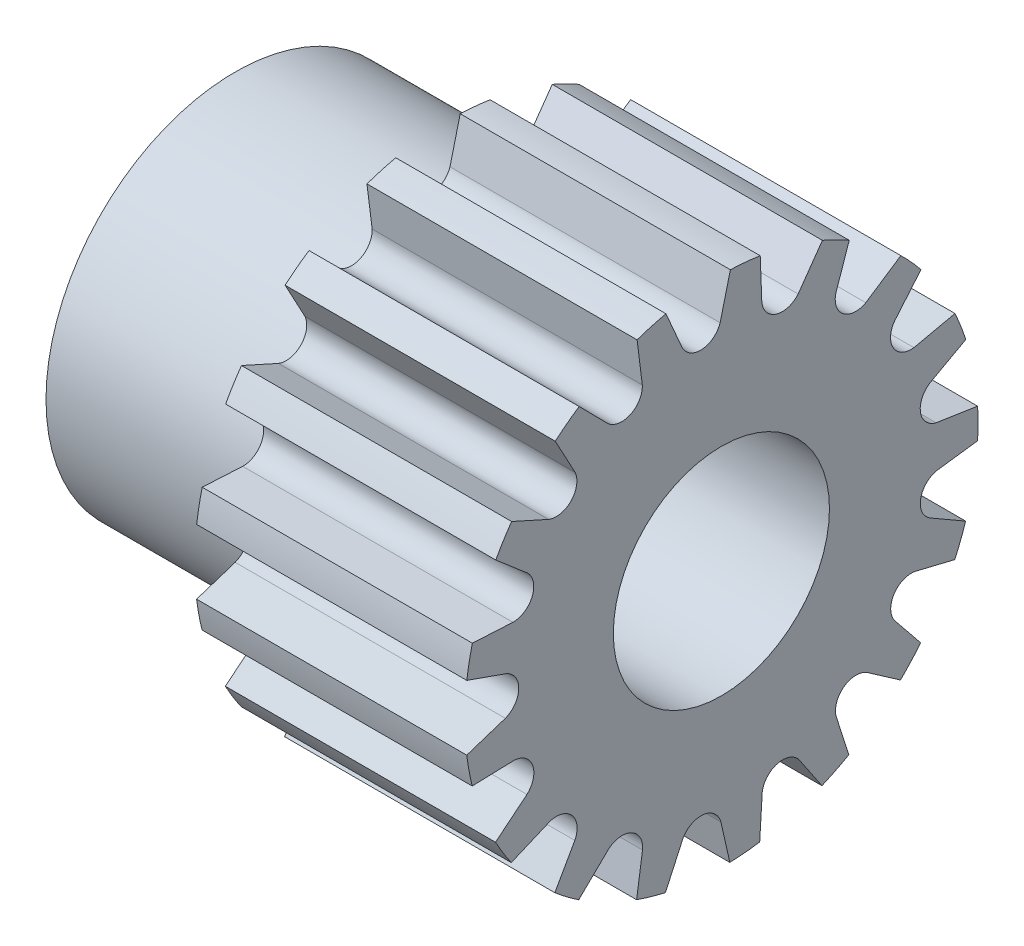
from build123d import *

# Parameters (mm, degrees)
SKETCH_2_R               = 4
CUT_EXTRUDE_1_DEPTH      = 20
CUT_EXTRUDE_2_DEPTH      = 10
PATTERN_CIRCULAR_1_COUNT = 17
SKETCH_4_R               = 2
CUT_EXTRUDE_3_DEPTH      = 10
SKETCH_5_R               = 2
CUT_EXTRUDE_4_DEPTH      = 10


with BuildPart() as part:
    # Эскиз1 → Повернуть1 (revolve)
    with BuildSketch(Plane.XY):
        Polygon((18, 0), (18, 9.5), (8, 9.5), (8, 7), (0, 7), (0, 0), align=None)
    revolve(axis=Axis((0, 0, 0), (1, 0, 0)))

    # Эскиз2 → Вырез-Вытянуть1 (cut)
    with BuildSketch(Plane.ZY):
        Circle(SKETCH_2_R)
    extrude(amount=-CUT_EXTRUDE_1_DEPTH, mode=Mode.SUBTRACT)

    # Эскиз3 → Вырез-Вытянуть2 (cut)
    with BuildSketch(Plane.ZY.offset(-8)):
        with BuildLine():
            Line((0.046298541, 7.983921855), (-0.332359624, 9.494184382))
            ThreePointArc((-0.332359624, 9.494184382), (0.866716129, 9.460380709), (2.051973159, 9.27574289))
            Line((2.051973159, 9.27574289), (1.455655646, 7.897482676))
            ThreePointArc((1.455655646, 7.897482676), (0.721917095, 7.466890324), (0.046298541, 7.983921855))
        make_face()
    cut_extrude_2 = extrude(amount=-CUT_EXTRUDE_2_DEPTH, mode=Mode.SUBTRACT)

    # Круговой массив1: Вырез-Вытянуть2 ×17 about axis
    pattern_circular_1_axis = Axis((18, 0, 0), (-1, 0, 0))
    for i in range(1, PATTERN_CIRCULAR_1_COUNT):
        add(cut_extrude_2.rotate(pattern_circular_1_axis, i * 360 / PATTERN_CIRCULAR_1_COUNT), mode=Mode.SUBTRACT)

    # Эскиз4 → Вырез-Вытянуть3 (cut)
    with BuildSketch(Plane(origin=(0, 0, 0), x_dir=(1, 0, 0), z_dir=(0, 1, 0))):
        with Locations((4, 0)):
            Circle(SKETCH_4_R)
    extrude(amount=-CUT_EXTRUDE_3_DEPTH, mode=Mode.SUBTRACT)

    # Эскиз5 → Вырез-Вытянуть4 (cut)
    with BuildSketch(Plane.XY):
        with Locations((4, 0)):
            Circle(SKETCH_5_R)
    extrude(amount=-CUT_EXTRUDE_4_DEPTH, mode=Mode.SUBTRACT)


solid = part.part
